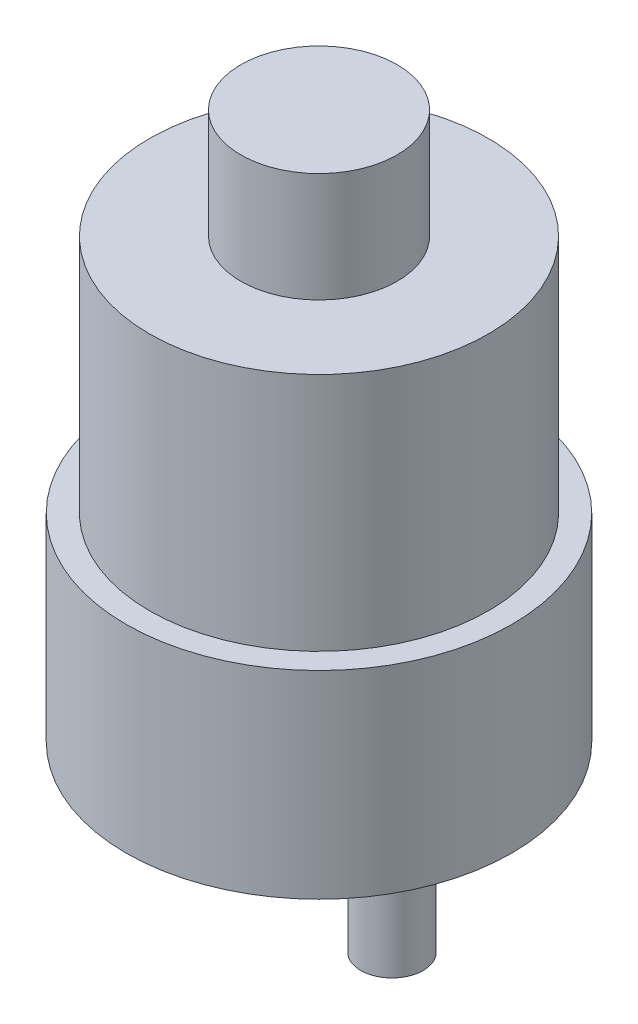
from build123d import *

# Parameters (mm, degrees)
SKETCH_1_R          = 18.5
EXTRUDE_4_DEPTH     = 19
SKETCH_1_4_R        = 6
EXTRUDE_5_DEPTH     = 6
EXTRUDE_6_DEPTH     = 21
SKETCH_1_6_R        = 1.365103645
CUT_EXTRUDE_2_DEPTH = 6
SKETCH_5_R          = 16.25
EXTRUDE_8_DEPTH     = 23
SKETCH_6_R          = 7.5
EXTRUDE_10_DEPTH    = 10.5


with BuildPart() as part:
    # 草图1 → 凸台-拉伸4 (new body)
    with BuildSketch(Plane(origin=(0, 0, 0), x_dir=(1, 0, 0), z_dir=(0, 1, 0))):
        Circle(SKETCH_1_R)
    extrude(amount=EXTRUDE_4_DEPTH)

    # 草图1<4> → 凸台-拉伸5 (add)
    with BuildSketch(Plane(origin=(0, 0, 0), x_dir=(1, 0, 0), z_dir=(0, 1, 0))):
        with Locations((0, 7)):
            Circle(SKETCH_1_4_R)
    extrude(amount=-EXTRUDE_5_DEPTH)

    # 草图1<5> → 凸台-拉伸6 (add)
    with BuildSketch(Plane(origin=(0, 0, 0), x_dir=(1, 0, 0), z_dir=(0, 1, 0))):
        with BuildLine():
            Line((-2.236067977, 9), (2.236067977, 9))
            ThreePointArc((2.236067977, 9), (0, 4), (-2.236067977, 9))
        make_face()
    extrude(amount=-EXTRUDE_6_DEPTH)

    # 草图1<6> → 切除-拉伸2 (cut)
    with BuildSketch(Plane(origin=(0, 0, 0), x_dir=(1, 0, 0), z_dir=(0, 1, 0))):
        with Locations((-15.5, 0)):
            Circle(SKETCH_1_6_R)
        with Locations((-7.75, 13.423393759)):
            Circle(SKETCH_1_6_R)
        with Locations((7.75, 13.423393759)):
            Circle(SKETCH_1_6_R)
        with Locations((15.5, 0)):
            Circle(SKETCH_1_6_R)
        with Locations((7.75, -13.423393759)):
            Circle(SKETCH_1_6_R)
        with Locations((-7.75, -13.423393759)):
            Circle(SKETCH_1_6_R)
    extrude(amount=CUT_EXTRUDE_2_DEPTH, mode=Mode.SUBTRACT)

    # 草图5 → 凸台-拉伸8 (add)
    with BuildSketch(Plane(origin=(0, 19, 0), x_dir=(1, 0, 0), z_dir=(0, 1, 0))):
        Circle(SKETCH_5_R)
    extrude(amount=EXTRUDE_8_DEPTH)

    # 草图6 → 凸台-拉伸10 (add)
    with BuildSketch(Plane(origin=(0, 42, 0), x_dir=(1, 0, 0), z_dir=(0, 1, 0))):
        Circle(SKETCH_6_R)
    extrude(amount=EXTRUDE_10_DEPTH)


solid = part.part
